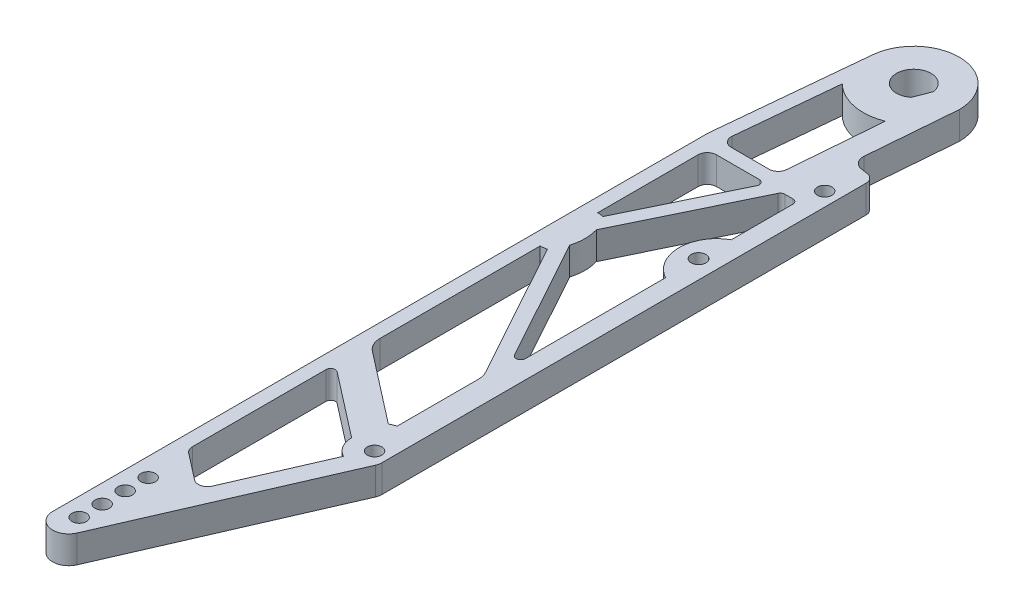
from build123d import *

# Parameters (mm, degrees)
SKETCH2_R           = 2
SKETCH2_R_2         = 1.999999991
BOSS_EXTRUDE1_DEPTH = 7.62
SKETCH7_R           = 2.032
CUT_EXTRUDE1_DEPTH  = 7.62


with BuildPart() as part:
    # Sketch2 → Boss-Extrude1 (new body)
    with BuildSketch(Plane(origin=(0, 0, 0), x_dir=(1, 0, 0), z_dir=(0, 1, 0))):
        with BuildLine():
            ThreePointArc((17.295902343, -30.526810701), (16.688093876, -28.878103365), (15.15555913, -28.018449791))
            Line((15.15555913, -28.018449791), (13.238676936, -27.713033224))
            ThreePointArc((13.238676936, -27.713033224), (11.241051513, -26.538356195), (10.573787778, -24.319092227))
            Line((10.573787778, -24.319092227), (12.5603, 0))
            ThreePointArc((12.5603, 0), (0.603657177, 12.545785512), (-12.502275592, 1.2059192))
            Line((-12.502275592, 1.2059192), (-16.498266045, -40.222207921))
            ThreePointArc((-16.498266045, -40.222207921), (-16.507064815, -40.344000039), (-16.51, -40.466074291))
            Line((-16.51, -40.466074291), (-16.51, -221.328861788))
            ThreePointArc((-16.51, -221.328861788), (-12.970187584, -225.680718913), (-7.988667969, -223.101301399))
            Line((-7.988667969, -223.101301399), (16.979901226, -165.677523619))
            ThreePointArc((16.979901226, -165.677523619), (17.216065593, -164.934164738), (17.295902343, -164.158289667))
            Line((17.295902343, -164.158289667), (17.295902343, -30.526810701))
        make_face()
        with Locations(Location((-11.43, -219.075, 0), (0, 0, 90))):
            Circle(SKETCH2_R, mode=Mode.SUBTRACT)
        with Locations(Location((-11.43, -212.725, 0), (0, 0, 90))):
            Circle(SKETCH2_R, mode=Mode.SUBTRACT)
        with Locations(Location((-11.43, -206.375, 0), (0, 0, 90))):
            Circle(SKETCH2_R, mode=Mode.SUBTRACT)
        with Locations(Location((-11.43, -200.025, 0), (0, 0, 90))):
            Circle(SKETCH2_R, mode=Mode.SUBTRACT)
        with BuildLine():
            ThreePointArc((7.135902343, -162.410770806), (8.023611961, -165.648962244), (10.438542905, -167.981776143))
            Line((10.438542905, -167.981776143), (-0.534170778, -193.217289931))
            ThreePointArc((-0.534170778, -193.217289931), (-2.234040931, -194.665234867), (-4.420389569, -194.211381682))
            Line((-4.420389569, -194.211381682), (-11.716886202, -188.551043102))
            ThreePointArc((-11.716886202, -188.551043102), (-12.441018517, -187.661516081), (-12.7, -186.544128716))
            Line((-12.7, -186.544128716), (-12.7, -149.615408258))
            ThreePointArc((-12.7, -149.615408258), (-11.988693683, -148.474898999), (-10.651556899, -148.611951065))
            Line((-10.651556899, -148.611951065), (7.135902343, -162.410770806))
        make_face(mode=Mode.SUBTRACT)
        with BuildLine():
            ThreePointArc((10.656105825, -153.315833936), (9.771695946, -153.639779081), (8.923603828, -154.049487576))
            Line((8.923603828, -154.049487576), (-10.733772403, -138.80005889))
            ThreePointArc((-10.733772403, -138.80005889), (-12.182037035, -137.021004847), (-12.7, -134.786230117))
            Line((-12.7, -134.786230117), (-12.7, -90.4875))
            ThreePointArc((-12.7, -90.4875), (-11.803536501, -90.43671411), (-10.918544548, -90.285006317))
            Line((-10.918544548, -90.285006317), (10.027134635, -128.362607876))
            ThreePointArc((10.027134635, -128.362607876), (10.49635106, -129.547067395), (10.656105825, -130.811024207))
            Line((10.656105825, -130.811024207), (10.656105825, -153.315833936))
        make_face(mode=Mode.SUBTRACT)
        with Locations(Location((13.485902343, -162.410770806, 0), (0, 0, 90))):
            Circle(SKETCH2_R, mode=Mode.SUBTRACT)
        with BuildLine():
            Line((-10.16, -44.337182032), (1.663048834, -44.337182032))
            ThreePointArc((1.663048834, -44.337182032), (2.739129831, -44.932682449), (2.806066447, -46.160725831))
            Line((2.806066447, -46.160725831), (-11.055993219, -74.784618621))
            ThreePointArc((-11.055993219, -74.784618621), (-11.873503915, -74.655646925), (-12.7, -74.6125))
            Line((-12.7, -74.6125), (-12.7, -46.877182032))
            ThreePointArc((-12.7, -46.877182032), (-11.956051224, -45.081130808), (-10.16, -44.337182032))
        make_face(mode=Mode.SUBTRACT)
        with BuildLine():
            ThreePointArc((-9.903213406, -40.527182032), (-11.783508673, -39.694838236), (-12.431479451, -37.743315662))
            Line((-12.431479451, -37.743315662), (-9.755434212, -9.99962016))
            ThreePointArc((-9.755434212, -9.99962016), (-2.756273581, -13.695395429), (5.127655889, -12.99492382))
            Line((5.127655889, -12.99492382), (3.069264048, -38.19397392))
            ThreePointArc((3.069264048, -38.19397392), (2.259083254, -39.854914801), (0.537695935, -40.527182032))
            Line((0.537695935, -40.527182032), (-9.903213406, -40.527182032))
        make_face(mode=Mode.SUBTRACT)
        with BuildLine():
            ThreePointArc((2.999946232, -3.71521973), (-4.455639512, 1.717501551), (4.717447783, 0.740419782))
            Line((4.717447783, 0.740419782), (2.999946232, -3.71521973))
        make_face(mode=Mode.SUBTRACT)
        with BuildLine():
            ThreePointArc((-8.804706991, -86.222769023), (-8.262040897, -82.55), (-8.804706991, -78.877230977))
            Line((-8.804706991, -78.877230977), (7.575478058, -45.053638233))
            ThreePointArc((7.575478058, -45.053638233), (8.043996088, -44.531101035), (8.718495671, -44.337182032))
            Line((8.718495671, -44.337182032), (10.945902343, -44.337182032))
            ThreePointArc((10.945902343, -44.337182032), (11.843927955, -44.70915642), (12.215902343, -45.607182032))
            Line((12.215902343, -45.607182032), (12.215902343, -62.618124667))
            ThreePointArc((12.215902343, -62.618124667), (6.881902343, -71.709053992), (12.215902343, -80.799983318))
            Line((12.215902343, -80.799983318), (12.215902343, -119.492817968))
            ThreePointArc((12.215902343, -119.492817968), (11.261891546, -120.722879277), (9.83314514, -120.104922051))
            Line((9.83314514, -120.104922051), (-8.804706991, -86.222769023))
        make_face(mode=Mode.SUBTRACT)
        with Locations(Location((13.485902343, -38.1, 0), (0, 0, 90))):
            Circle(SKETCH2_R_2, mode=Mode.SUBTRACT)
    extrude(amount=BOSS_EXTRUDE1_DEPTH)

    # Sketch7 → Cut-Extrude1 (cut)
    with BuildSketch(Plane(origin=(0, 7.62, 0), x_dir=(1, 0, 0), z_dir=(0, 1, 0))):
        with Locations(Location((12.215902343, -71.655983318, 0), (0, 0, 270))):
            Circle(SKETCH7_R)
    extrude(amount=-CUT_EXTRUDE1_DEPTH, mode=Mode.SUBTRACT)


solid = part.part
